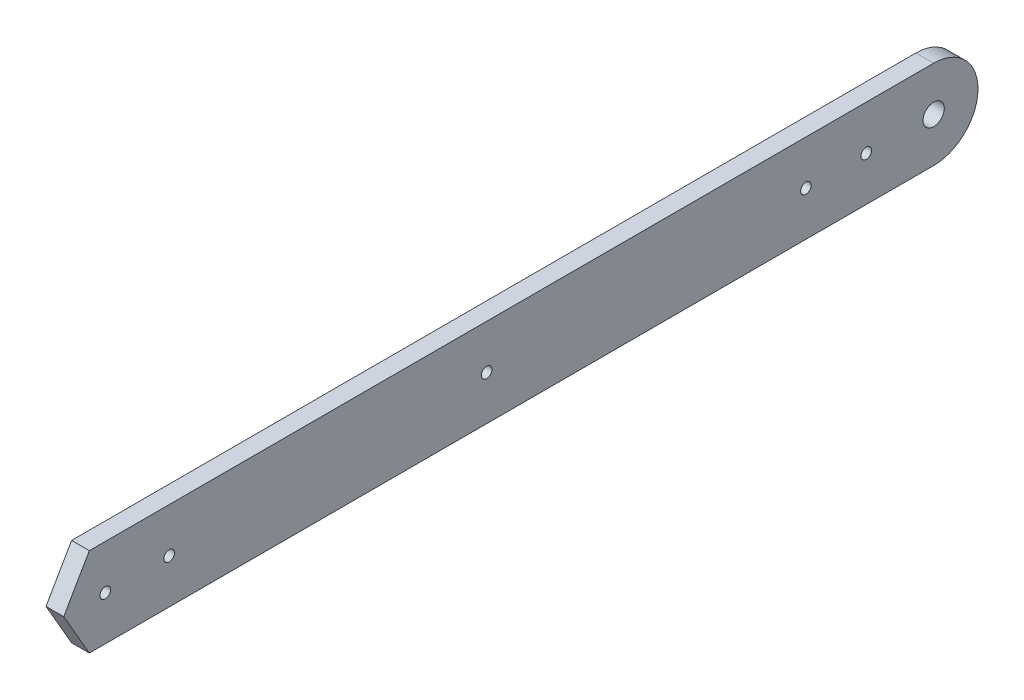
from build123d import *

# Parameters (mm, degrees)
SKETCH1_W           = 5
SKETCH1_H           = 25
BOSS_EXTRUDE1_DEPTH = 258.5
SKETCH2_R           = 3
SKETCH2_R_2         = 1.5
CUT_EXTRUDE1_DEPTH  = 259.850342862


with BuildPart() as part:
    # Sketch1 → Boss-Extrude1 (new body)
    with BuildSketch(Plane.XY):
        Rectangle(SKETCH1_W, SKETCH1_H)
    extrude(amount=BOSS_EXTRUDE1_DEPTH)

    # Sketch2 → Cut-Extrude1 (cut, through all)
    with BuildSketch(Plane(origin=(2.5, 0, 0), x_dir=(0, 0, -1), z_dir=(1, 0, 0))):
        with Locations((-12.5, 0)):
            Circle(SKETCH2_R)
        with Locations((-246, 0)):
            Circle(SKETCH2_R_2)
        with Locations((-228, 0)):
            Circle(SKETCH2_R_2)
        with Locations((-48.5, 0)):
            Circle(SKETCH2_R_2)
        with Locations((-31.5, 0)):
            Circle(SKETCH2_R_2)
        with Locations((-138.5, 0)):
            Circle(SKETCH2_R_2)
        with BuildLine():
            Line((-12.5, 12.5), (5.5, 12.5))
            Line((5.5, 12.5), (5.5, -12.5))
            Line((5.5, -12.5), (-12.5, -12.5))
            ThreePointArc((-12.5, -12.5), (0, 0), (-12.5, 12.5))
        make_face()
        Polygon((-257.716878365, 0), (-250.5, 12.5), (-258.5, 12.5), (-258.5, -12.5), (-250.5, -12.5), align=None)
    extrude(amount=-CUT_EXTRUDE1_DEPTH, mode=Mode.SUBTRACT)


solid = part.part
